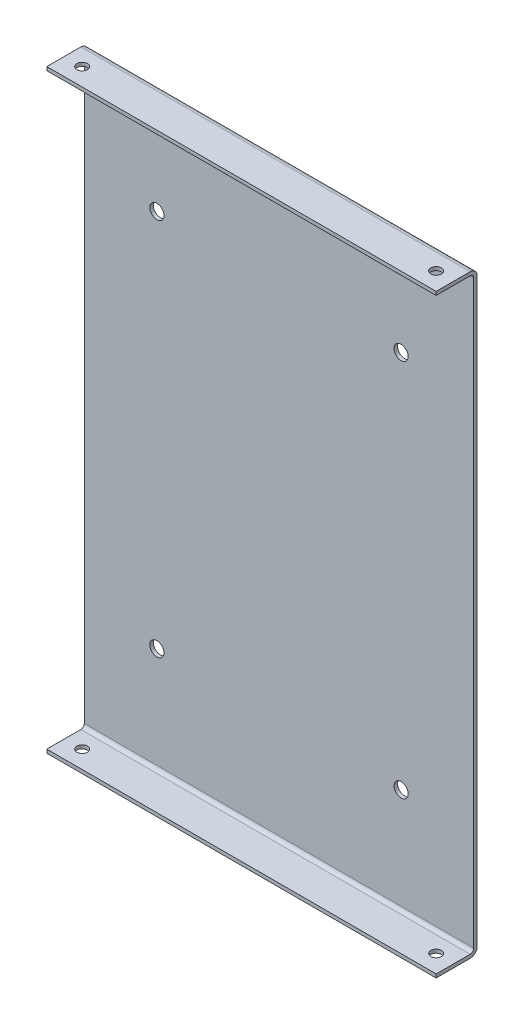
from build123d import *

# Parameters (mm, degrees)
ESQUISSE1_W             = 110
ESQUISSE1_H             = 168
ESQUISSE1_R             = 2
BOSS_EXTRU_1_DEPTH      = 1
ESQUISSE2_W             = 110
ESQUISSE2_H             = 1
BOSS_EXTRU_2_DEPTH      = 10.6
CONG_1_R                = 2
CONG_2_R                = 1
ESQUISSE3_R             = 1.5
ENL_V_MAT_EXTRU_1_DEPTH = 202.143133117


with BuildPart() as part:
    # Esquisse1 → Boss.-Extru.1 (new body)
    with BuildSketch(Plane.XY):
        with Locations((55, -84)):
            Rectangle(ESQUISSE1_W, ESQUISSE1_H)
        with Locations((20.5, -30.5)):
            Circle(ESQUISSE1_R, mode=Mode.SUBTRACT)
        with Locations((89.5, -30.5)):
            Circle(ESQUISSE1_R, mode=Mode.SUBTRACT)
        with Locations((89.5, -137.5)):
            Circle(ESQUISSE1_R, mode=Mode.SUBTRACT)
        with Locations((20.5, -137.5)):
            Circle(ESQUISSE1_R, mode=Mode.SUBTRACT)
    extrude(amount=BOSS_EXTRU_1_DEPTH)

    # Esquisse2 → Boss.-Extru.2 (add)
    with BuildSketch(Plane.XY.offset(1)):
        with Locations((55, -167.5)):
            Rectangle(ESQUISSE2_W, ESQUISSE2_H)
        with Locations((55, -0.5)):
            Rectangle(ESQUISSE2_W, ESQUISSE2_H)
    extrude(amount=BOSS_EXTRU_2_DEPTH)

    # Congé1
    cong_1_edges = [part.edges().sort_by_distance(p)[0] for p in [
        (55, 0, 0),
        (55, -168, 0),
    ]]
    fillet(cong_1_edges, radius=CONG_1_R)

    # Congé2
    cong_2_edges = [part.edges().sort_by_distance(p)[0] for p in [
        (55, -167, 1),
        (55, -1, 1),
    ]]
    fillet(cong_2_edges, radius=CONG_2_R)

    # Esquisse3 → Enlèv. mat.-Extru.1 (cut, through all)
    with BuildSketch(Plane(origin=(0, 0, 0), x_dir=(1, 0, 0), z_dir=(0, 1, 0))):
        with Locations(Location((105, -6.6, 0), (0, 0, 270))):
            Circle(ESQUISSE3_R)
        with Locations(Location((5, -6.6, 0), (0, 0, 270))):
            Circle(ESQUISSE3_R)
    extrude(amount=-ENL_V_MAT_EXTRU_1_DEPTH, mode=Mode.SUBTRACT)


solid = part.part
